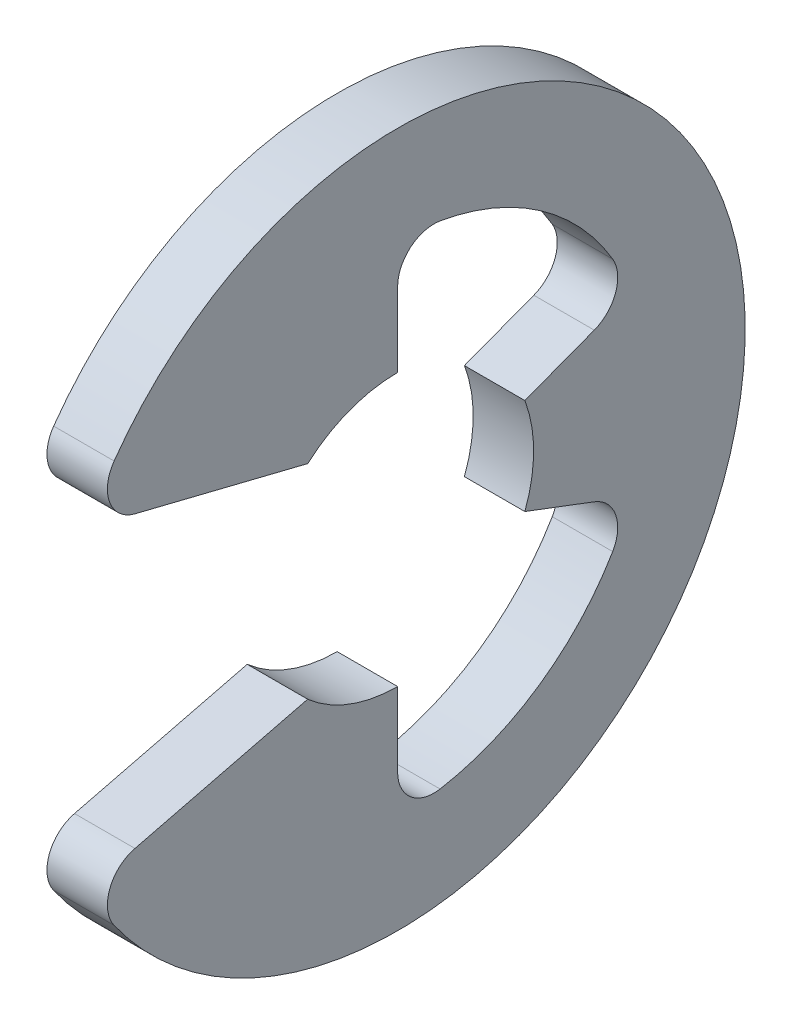
from build123d import *

# Parameters (mm, degrees)
EXTRUDE1_DEPTH = 0.3
FILLET1_R      = 0.36


with BuildPart() as part:
    # Sketch1 → Extrude1 (new, symmetric)
    with BuildSketch(Plane(origin=(0, 0, 0), x_dir=(0, 0, -1), z_dir=(1, 0, 0))):
        with BuildLine():
            Line((-3.079508789, -1.555353856), (-0.892941067, -1.0125))
            ThreePointArc((-0.892941067, -1.0125), (-0.477297077, -1.262809368), (0, -1.35))
            Line((0, -1.35), (0, -2.477419355))
            ThreePointArc((0, -2.477419355), (1.408480567, -2.038084677), (2.317413607, -0.875900013))
            Line((2.317413607, -0.875900013), (1.262809368, -0.477297077))
            ThreePointArc((1.262809368, -0.477297077), (1.35, 0), (1.262809368, 0.477297077))
            Line((1.262809368, 0.477297077), (2.317413607, 0.875900013))
            ThreePointArc((2.317413607, 0.875900013), (1.408480567, 2.038084677), (0, 2.477419355))
            Line((0, 2.477419355), (0, 1.35))
            ThreePointArc((0, 1.35), (-0.477297077, 1.262809368), (-0.892941067, 1.0125))
            Line((-0.892941067, 1.0125), (-3.079508789, 1.555353856))
            ThreePointArc((-3.079508789, 1.555353856), (3.45, 0), (-3.079508789, -1.555353856))
        make_face()
    extrude(amount=EXTRUDE1_DEPTH, both=True)

    # Fillet1
    fillet1_edges = [part.edges().sort_by_distance(p)[0] for p in [
        (0, -1.555353856, 3.079508789),
        (0, -2.477419355, 0),
        (0, -0.875900013, -2.317413607),
        (0, 0.875900013, -2.317413607),
        (0, 2.477419355, 0),
        (0, 1.555353856, 3.079508789),
    ]]
    fillet(fillet1_edges, radius=FILLET1_R)


solid = part.part
